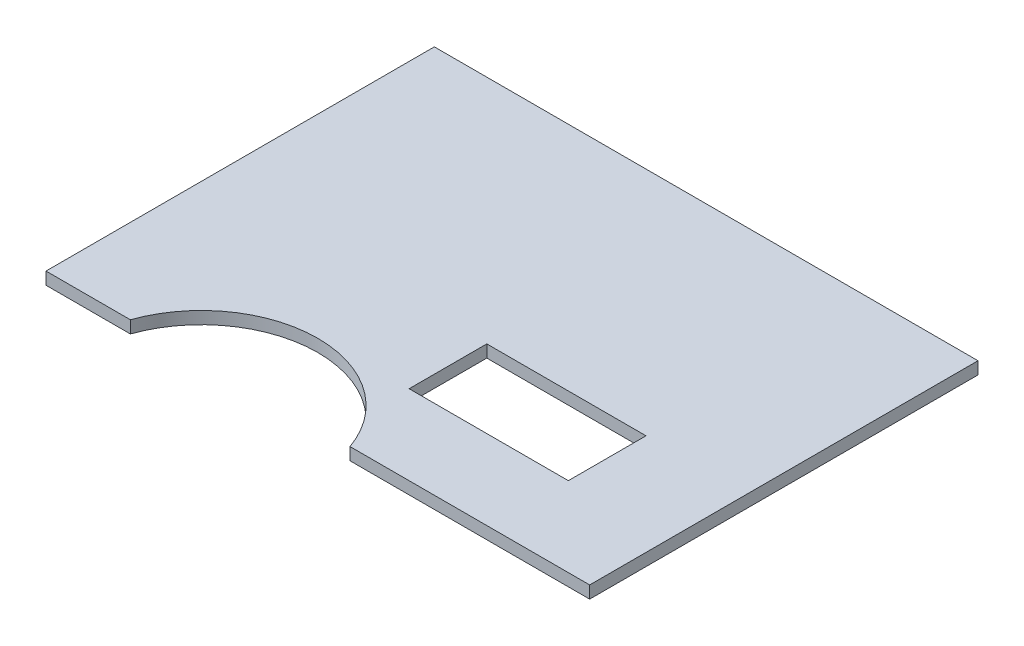
from build123d import *

# Parameters (mm, degrees)
SKETCH1_W           = 140
SKETCH1_H           = 100
BOSS_EXTRUDE1_DEPTH = 3.175
SKETCH2_W           = 41
SKETCH2_H           = 20
CUT_EXTRUDE1_DEPTH  = 10
SKETCH3_R           = 30
CUT_EXTRUDE2_DEPTH  = 10


with BuildPart() as part:
    # Sketch1 → Boss-Extrude1 (new body)
    with BuildSketch(Plane(origin=(0, 0, 0), x_dir=(1, 0, 0), z_dir=(0, 1, 0))):
        with Locations((70, 50)):
            Rectangle(SKETCH1_W, SKETCH1_H)
    extrude(amount=BOSS_EXTRUDE1_DEPTH)

    # Sketch2 → Cut-Extrude1 (cut)
    with BuildSketch(Plane(origin=(0, 3.175, 0), x_dir=(1, 0, 0), z_dir=(0, 1, 0))):
        with Locations((93.5, 30.51)):
            Rectangle(SKETCH2_W, SKETCH2_H)
    extrude(amount=-CUT_EXTRUDE1_DEPTH, mode=Mode.SUBTRACT)

    # Sketch3 → Cut-Extrude2 (cut)
    with BuildSketch(Plane(origin=(0, 3.175, 0), x_dir=(1, 0, 0), z_dir=(0, 1, 0))):
        with Locations((50, -10)):
            Circle(SKETCH3_R)
    extrude(amount=-CUT_EXTRUDE2_DEPTH, mode=Mode.SUBTRACT)


solid = part.part
